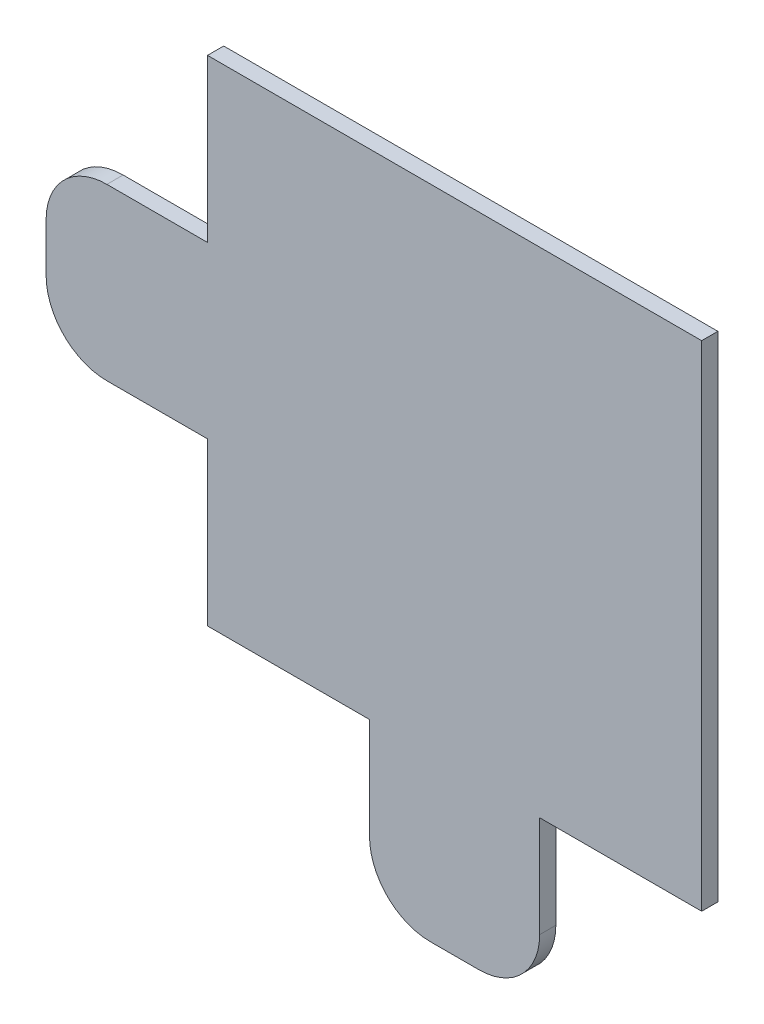
from build123d import *

# Parameters (mm, degrees)
BOSS_EXTRUDE1_DEPTH = 0.01


with BuildPart() as part:
    # Sketch1 → Boss-Extrude1 (new, symmetric)
    with BuildSketch(Plane.XY):
        with BuildLine():
            Line((-0.305, 0.325), (-0.305, 0.125))
            Line((-0.305, 0.125), (-0.429197649, 0.125))
            ThreePointArc((-0.429197649, 0.125), (-0.482230658, 0.103033009), (-0.504197649, 0.05))
            Line((-0.504197649, 0.05), (-0.504197649, -0.01))
            ThreePointArc((-0.504197649, -0.01), (-0.482230658, -0.063033009), (-0.429197649, -0.085))
            Line((-0.429197649, -0.085), (-0.305, -0.085))
            Line((-0.305, -0.085), (-0.305, -0.285))
            Line((-0.305, -0.285), (-0.105, -0.285))
            Line((-0.105, -0.285), (-0.105, -0.41))
            ThreePointArc((-0.105, -0.41), (-0.083033009, -0.463033009), (-0.03, -0.485))
            Line((-0.03, -0.485), (0.03, -0.485))
            ThreePointArc((0.03, -0.485), (0.083033009, -0.463033009), (0.105, -0.41))
            Line((0.105, -0.41), (0.105, -0.285))
            Line((0.105, -0.285), (0.305, -0.285))
            Line((0.305, -0.285), (0.305, 0.325))
            Line((0.305, 0.325), (-0.305, 0.325))
        make_face()
    extrude(amount=BOSS_EXTRUDE1_DEPTH, both=True)


solid = part.part
